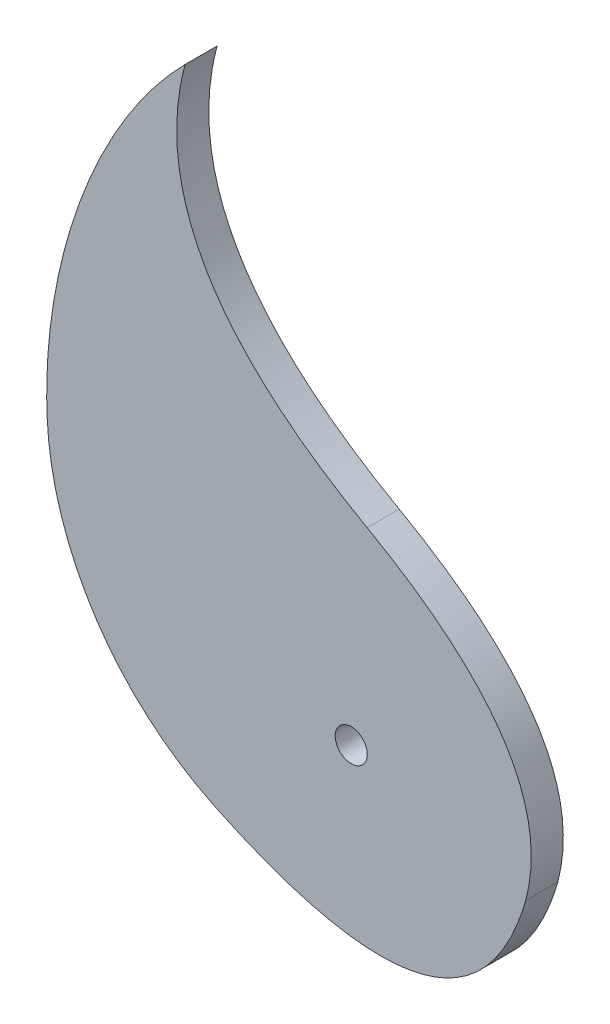
from build123d import *

# Parameters (mm, degrees)
BOSS_EXTRUDE1_DEPTH = 6.35
SKETCH2_R           = 3.175
CUT_EXTRUDE1_DEPTH  = 76.2
FILLET1_R           = 58.42


with BuildPart() as part:
    # Sketch1 → Boss-Extrude1 (new body)
    with BuildSketch(Plane.XY):
        with BuildLine():
            add(Edge.make_bspline(
                [(0, 0), (38.404098046, -21.59977719), (31.400899659, -48.21557496)],
                knots=[0, 0, 0, 0.881342447, 0.881342447, 0.881342447], degree=2))
            add(Edge.make_bspline(
                [(0, 0), (-45.575290821, 25.610850897), (-36.060387995, 61.383694171)],
                knots=[0, 0, 0, 1, 1, 1], degree=2))
            add(Edge.make_bspline(
                [(-36.060387995, 61.383694171), (-62.615286542, 34.594392179), (-74.116408577, -18.870814993), (-51.051785251, -51.254371701)],
                knots=[0, 0, 0, 0, 1, 1, 1, 1], degree=3))
            add(Edge.make_bspline(
                [(-51.051785251, -51.254371701), (12.058894693, -90.706625614), (28.692128455, -55.473211038)],
                knots=[0, 0, 0, 0.914335656, 0.914335656, 0.914335656], degree=2))
            add(Edge.make_bspline(
                [(28.692128455, -55.473211038), (30.250500418, -52.172183336), (31.400899659, -48.21557496)],
                knots=[0.914335656, 0.914335656, 0.914335656, 1, 1, 1], degree=2))
        make_face()
    extrude(amount=BOSS_EXTRUDE1_DEPTH)

    # Sketch2 → Cut-Extrude1 (cut)
    with BuildSketch(Plane.XY.offset(6.35)):
        with Locations((-3.152469771, -38.871385351)):
            Circle(SKETCH2_R)
    extrude(amount=-CUT_EXTRUDE1_DEPTH, mode=Mode.SUBTRACT)

    # Fillet1
    fillet1_edges = [part.edges().sort_by_distance(p)[0] for p in [
        (-51.051785251, -51.254371701, 3.175),
    ]]
    fillet(fillet1_edges, radius=FILLET1_R)


solid = part.part
